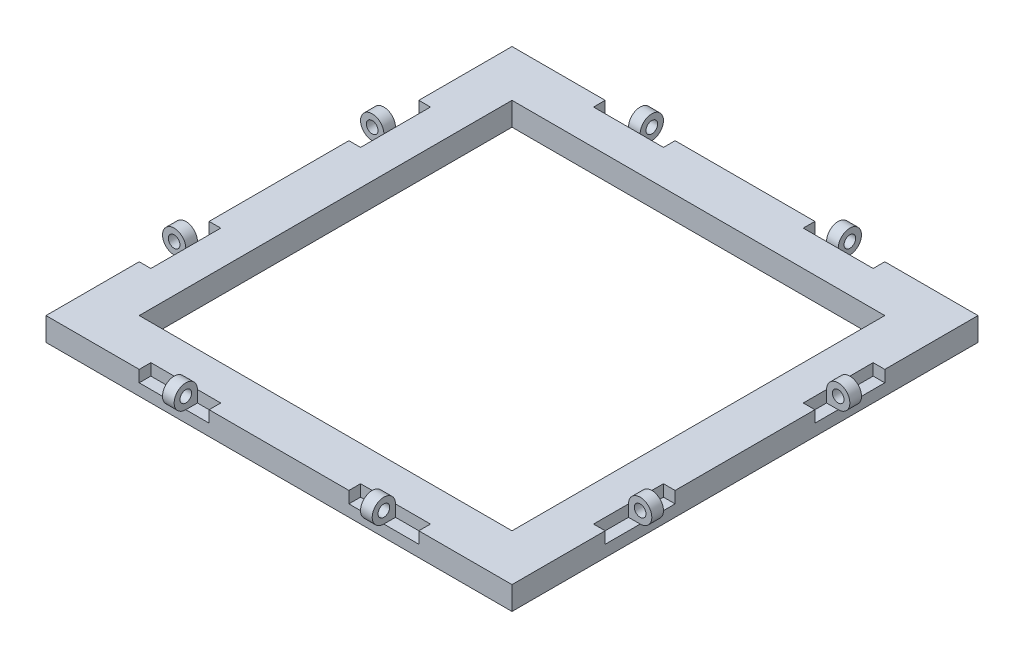
from build123d import *

# Parameters (mm, degrees)
SKETCH1_W                = 200
SKETCH1_H                = 200
SKETCH1_R                = 0.0005
BOSS_EXTRUDE1_DEPTH      = 10
SKETCH2_W                = 30
SKETCH2_H                = 5
CUT_EXTRUDE1_DEPTH       = 5
BOSS_EXTRUDE3_START      = 15
BOSS_EXTRUDE3_DEPTH      = 5
CIRPATTERN1_COUNT        = 4
CIRPATTERN1_START        = 15
CIRPATTERN1_COPY_1_DEPTH = 5
CIRPATTERN1_COPY_2_DEPTH = 5
CIRPATTERN1_COPY_3_DEPTH = 5
SKETCH4_W                = 160
SKETCH4_H                = 160
CUT_EXTRUDE2_DEPTH       = 10


with BuildPart() as part:
    # Sketch1 → Boss-Extrude1 (new body)
    with BuildSketch(Plane(origin=(0, 0, 0), x_dir=(1, 0, 0), z_dir=(0, 1, 0))):
        Rectangle(SKETCH1_W, SKETCH1_H)
        with Locations(Location((0, 0, 0), (0, 0, 270))):
            Circle(SKETCH1_R, mode=Mode.SUBTRACT)
    extrude(amount=BOSS_EXTRUDE1_DEPTH)

    # Sketch2 → Cut-Extrude1 (cut)
    with BuildSketch(Plane(origin=(0, 10, 0), x_dir=(1, 0, 0), z_dir=(0, 1, 0))):
        with Locations((45, 97.5)):
            Rectangle(SKETCH2_W, SKETCH2_H)
        with Locations((-45, 97.5)):
            Rectangle(SKETCH2_W, SKETCH2_H)
    cut_extrude1 = extrude(amount=-CUT_EXTRUDE1_DEPTH, mode=Mode.SUBTRACT)

    # Sketch3 → Boss-Extrude3 (add)
    with BuildSketch(Plane.ZY.offset(-60).offset(BOSS_EXTRUDE3_START)):
        with BuildLine():
            Line((-97.5, 10), (-95, 10))
            ThreePointArc((-95, 10), (-103.535533906, 13.535533906), (-100, 5))
            Line((-100, 5), (-100, 7.5))
            ThreePointArc((-100, 7.5), (-101.767766953, 11.767766953), (-97.5, 10))
        make_face()
        with BuildLine():
            ThreePointArc((-100, 5), (-96.464466094, 6.464466094), (-95, 10))
            Line((-95, 10), (-97.5, 10))
            ThreePointArc((-97.5, 10), (-98.232233047, 8.232233047), (-100, 7.5))
            Line((-100, 7.5), (-100, 5))
        make_face()
        with BuildLine():
            Line((-95, 5), (-95, 10))
            ThreePointArc((-95, 10), (-96.464466094, 6.464466094), (-100, 5))
            Line((-100, 5), (-95, 5))
        make_face()
    boss_extrude3 = extrude(amount=BOSS_EXTRUDE3_DEPTH)

    # Mirror1: Boss-Extrude3 across plane
    add(boss_extrude3.mirror(Plane(origin=(0, 0, 0), x_dir=(0, 0, 1), z_dir=(1, 0, 0))))

    # CirPattern1: Cut-Extrude1, Boss-Extrude3 ×4 about axis
    cirpattern1_axis = Axis((0, 0, 0), (0, 1, 0))
    add([cut_extrude1.rotate(cirpattern1_axis, i * 360 / CIRPATTERN1_COUNT) for i in range(1, CIRPATTERN1_COUNT)], mode=Mode.SUBTRACT)
    add([boss_extrude3.rotate(cirpattern1_axis, i * 360 / CIRPATTERN1_COUNT) for i in range(1, CIRPATTERN1_COUNT)])

    # CirPattern1 copy 1 sketch → CirPattern1 copy 1 (add)
    with BuildSketch(Plane(origin=(0, 0, 60), x_dir=(1, 0, 0), z_dir=(0, 0, -1)).offset(CIRPATTERN1_START)):
        with BuildLine():
            Line((-97.5, -10), (-95, -10))
            ThreePointArc((-95, -10), (-103.535533906, -13.535533906), (-100, -5))
            Line((-100, -5), (-100, -7.5))
            ThreePointArc((-100, -7.5), (-101.767766953, -11.767766953), (-97.5, -10))
        make_face()
        with BuildLine():
            ThreePointArc((-100, -5), (-96.464466094, -6.464466094), (-95, -10))
            Line((-95, -10), (-97.5, -10))
            ThreePointArc((-97.5, -10), (-98.232233047, -8.232233047), (-100, -7.5))
            Line((-100, -7.5), (-100, -5))
        make_face()
        with BuildLine():
            Line((-95, -5), (-95, -10))
            ThreePointArc((-95, -10), (-96.464466094, -6.464466094), (-100, -5))
            Line((-100, -5), (-95, -5))
        make_face()
    extrude(amount=CIRPATTERN1_COPY_1_DEPTH)

    # CirPattern1 copy 2 sketch → CirPattern1 copy 2 (add)
    with BuildSketch(Plane(origin=(60, 0, 0), x_dir=(0, 0, -1), z_dir=(-1, 0, 0)).offset(CIRPATTERN1_START)):
        with BuildLine():
            Line((-97.5, -10), (-95, -10))
            ThreePointArc((-95, -10), (-103.535533906, -13.535533906), (-100, -5))
            Line((-100, -5), (-100, -7.5))
            ThreePointArc((-100, -7.5), (-101.767766953, -11.767766953), (-97.5, -10))
        make_face()
        with BuildLine():
            ThreePointArc((-100, -5), (-96.464466094, -6.464466094), (-95, -10))
            Line((-95, -10), (-97.5, -10))
            ThreePointArc((-97.5, -10), (-98.232233047, -8.232233047), (-100, -7.5))
            Line((-100, -7.5), (-100, -5))
        make_face()
        with BuildLine():
            Line((-95, -5), (-95, -10))
            ThreePointArc((-95, -10), (-96.464466094, -6.464466094), (-100, -5))
            Line((-100, -5), (-95, -5))
        make_face()
    extrude(amount=CIRPATTERN1_COPY_2_DEPTH)

    # CirPattern1 copy 3 sketch → CirPattern1 copy 3 (add)
    with BuildSketch(Plane(origin=(0, 0, -60), x_dir=(-1, 0, 0), z_dir=(0, 0, 1)).offset(CIRPATTERN1_START)):
        with BuildLine():
            Line((-97.5, -10), (-95, -10))
            ThreePointArc((-95, -10), (-103.535533906, -13.535533906), (-100, -5))
            Line((-100, -5), (-100, -7.5))
            ThreePointArc((-100, -7.5), (-101.767766953, -11.767766953), (-97.5, -10))
        make_face()
        with BuildLine():
            ThreePointArc((-100, -5), (-96.464466094, -6.464466094), (-95, -10))
            Line((-95, -10), (-97.5, -10))
            ThreePointArc((-97.5, -10), (-98.232233047, -8.232233047), (-100, -7.5))
            Line((-100, -7.5), (-100, -5))
        make_face()
        with BuildLine():
            Line((-95, -5), (-95, -10))
            ThreePointArc((-95, -10), (-96.464466094, -6.464466094), (-100, -5))
            Line((-100, -5), (-95, -5))
        make_face()
    extrude(amount=CIRPATTERN1_COPY_3_DEPTH)

    # Sketch4 → Cut-Extrude2 (cut)
    with BuildSketch(Plane(origin=(0, 10, 0), x_dir=(1, 0, 0), z_dir=(0, 1, 0))):
        Rectangle(SKETCH4_W, SKETCH4_H)
    extrude(amount=-CUT_EXTRUDE2_DEPTH, mode=Mode.SUBTRACT)


solid = part.part
